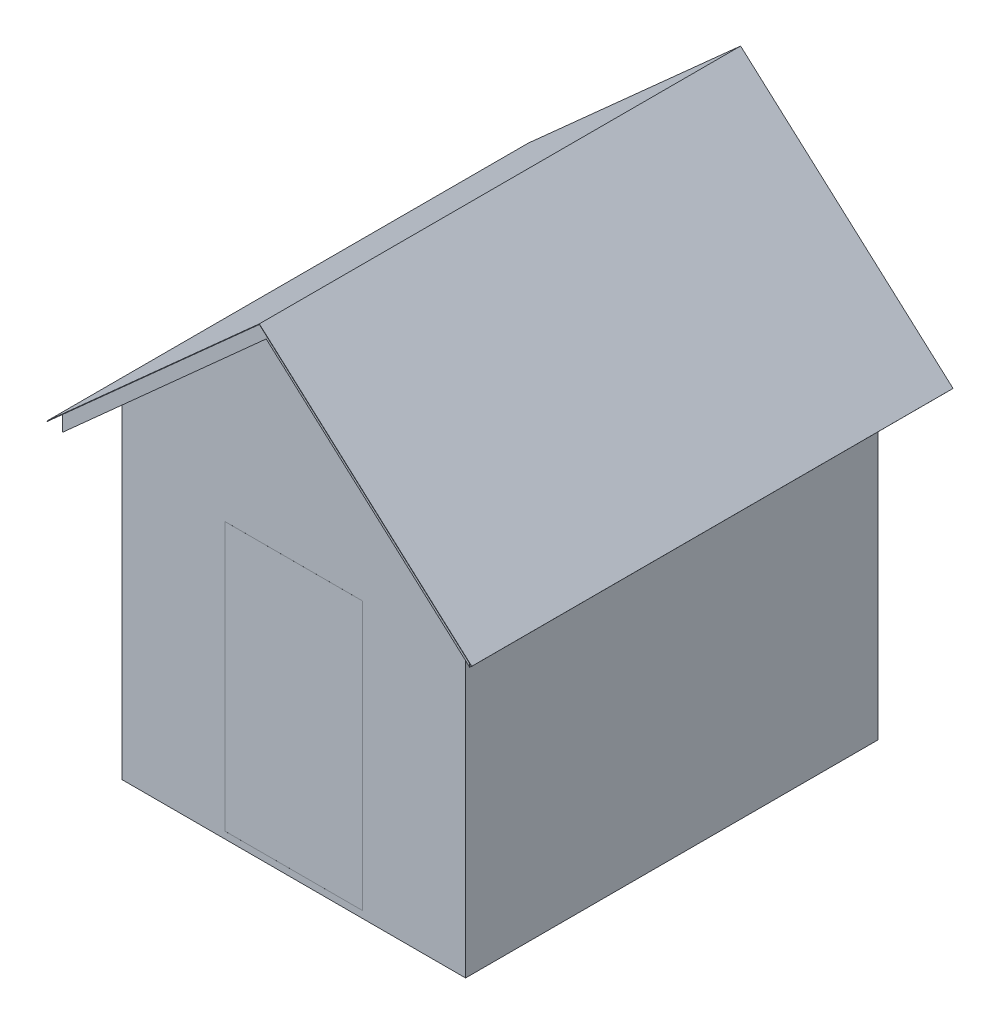
from build123d import *

# Parameters (mm, degrees)
SKETCH1_W                = 2500
SKETCH1_H                = 3000
BOSS_EXTRUDE1_DEPTH      = 3500
CUT_EXTRUDE1_DEPTH       = 3500
SHELL1_T                 = -100
SKETCH3_W                = 1000
SKETCH3_H                = 1950
CUT_EXTRUDE3_DEPTH       = 496
SKETCH4_W                = 999.750286032
SKETCH4_H                = 1949.830893164
BOSS_EXTRUDE2_DEPTH      = 100
BOSS_EXTRUDE3_DEPTH      = 200
BOSS_EXTRUDE3_DEPTH_BACK = 3200
EXTRUDE_THIN1_DEPTH      = 50
EXTRUDE_THIN1_DEPTH_BACK = 3450


with BuildPart() as part:
    # Sketch1 → Boss-Extrude1 (new body)
    with BuildSketch(Plane(origin=(0, 0, 0), x_dir=(1, 0, 0), z_dir=(0, 1, 0))):
        Rectangle(SKETCH1_W, SKETCH1_H)
    extrude(amount=BOSS_EXTRUDE1_DEPTH)

    # Sketch2 → Cut-Extrude1 (cut)
    with BuildSketch(Plane.XY.offset(1500)):
        Polygon((0, 3500), (-1250, 2378.609609687), (-1250, 3819.872542734), (1250, 3819.872542734), (1250, 2378.609609687), align=None)
    extrude(amount=-CUT_EXTRUDE1_DEPTH, mode=Mode.SUBTRACT)

    # Shell1
    shell1_openings = [part.faces().sort_by_distance(p)[0] for p in [
        (625, 2939.304804843, 0),
        (-625, 2939.304804843, 0),
    ]]
    offset(amount=SHELL1_T, openings=shell1_openings, kind=Kind.INTERSECTION)

    # Sketch3 → Cut-Extrude3 (cut)
    with BuildSketch(Plane.XY.offset(1500)):
        with Locations((0, 1025)):
            Rectangle(SKETCH3_W, SKETCH3_H)
    extrude(amount=-CUT_EXTRUDE3_DEPTH, mode=Mode.SUBTRACT)


with BuildPart() as body_2:
    # Sketch4 → Boss-Extrude2 (new body)
    with BuildSketch(Plane.XY.offset(1500)):
        with Locations((0.000917564, 1024.965737465)):
            Rectangle(SKETCH4_W, SKETCH4_H)
    extrude(amount=-BOSS_EXTRUDE2_DEPTH)


with BuildPart() as body_3:
    # Sketch5 → Boss-Extrude3 (new, two sides: drawn at the far end of the back side and taken through both)
    with BuildSketch(Plane(origin=(0, 0, -1500), x_dir=(-1, 0, 0), z_dir=(0, 0, -1)).offset(-BOSS_EXTRUDE3_DEPTH_BACK)):
        Polygon((0, 3500), (-1480.231275032, 2172.066298191), (-1480.231275032, 2292.048640299), (0, 3619.982342108), (1480.231275032, 2292.048640299), (1480.231275032, 2172.066298191), align=None)
    extrude(amount=BOSS_EXTRUDE3_DEPTH + BOSS_EXTRUDE3_DEPTH_BACK)


with BuildPart() as body_4:
    # Sketch6 → Extrude-Thin1 (new, two sides: drawn at the far end of the back side and taken through both)
    with BuildSketch(Plane.XY.offset(1700).offset(-EXTRUDE_THIN1_DEPTH_BACK)):
        Polygon((-1544.54053077, 2235.916805511), (0, 3619.982342108), (1545.192552172, 2235.916805511), (1543.19094317, 2233.682177712), (0.000422446, 3615.954447362), (-1542.538453075, 2233.682597619), align=None)
    extrude(amount=EXTRUDE_THIN1_DEPTH + EXTRUDE_THIN1_DEPTH_BACK)


solid = Compound([part.part, body_2.part, body_3.part, body_4.part])
